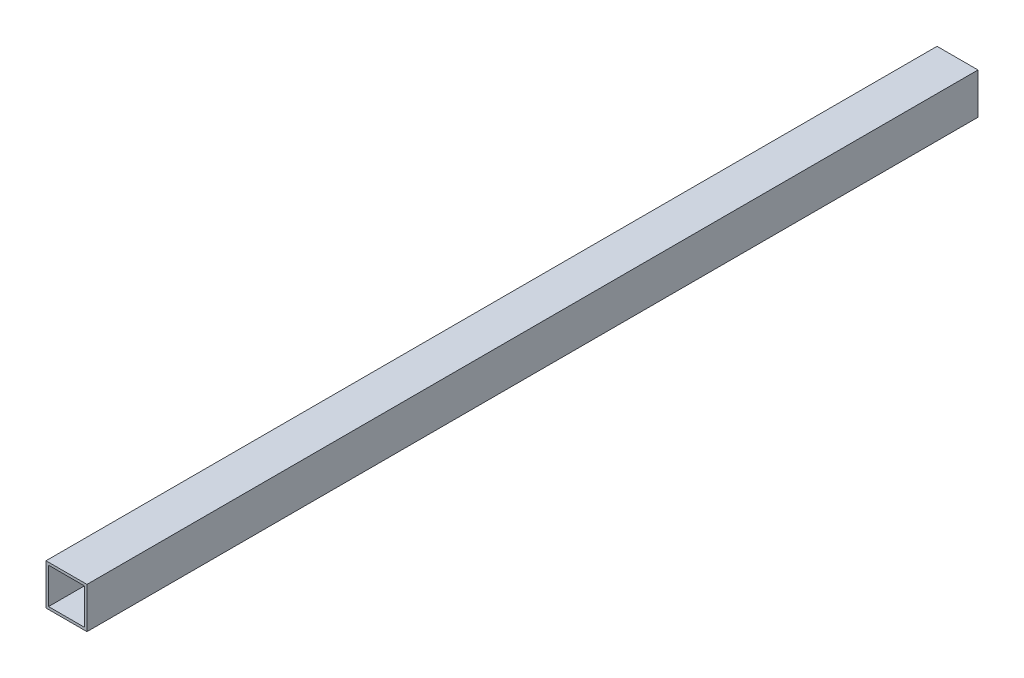
from build123d import *

# Parameters (mm, degrees)
SKETCH1_W           = 50.8
SKETCH1_H           = 50.8
SKETCH1_W_2         = 44.45
SKETCH1_H_2         = 44.45
BOSS_EXTRUDE1_DEPTH = 1104.9


with BuildPart() as part:
    # Sketch1 → Boss-Extrude1 (new body)
    with BuildSketch(Plane.XY):
        Rectangle(SKETCH1_W, SKETCH1_H)
        Rectangle(SKETCH1_W_2, SKETCH1_H_2, mode=Mode.SUBTRACT)
    extrude(amount=-BOSS_EXTRUDE1_DEPTH)


solid = part.part
